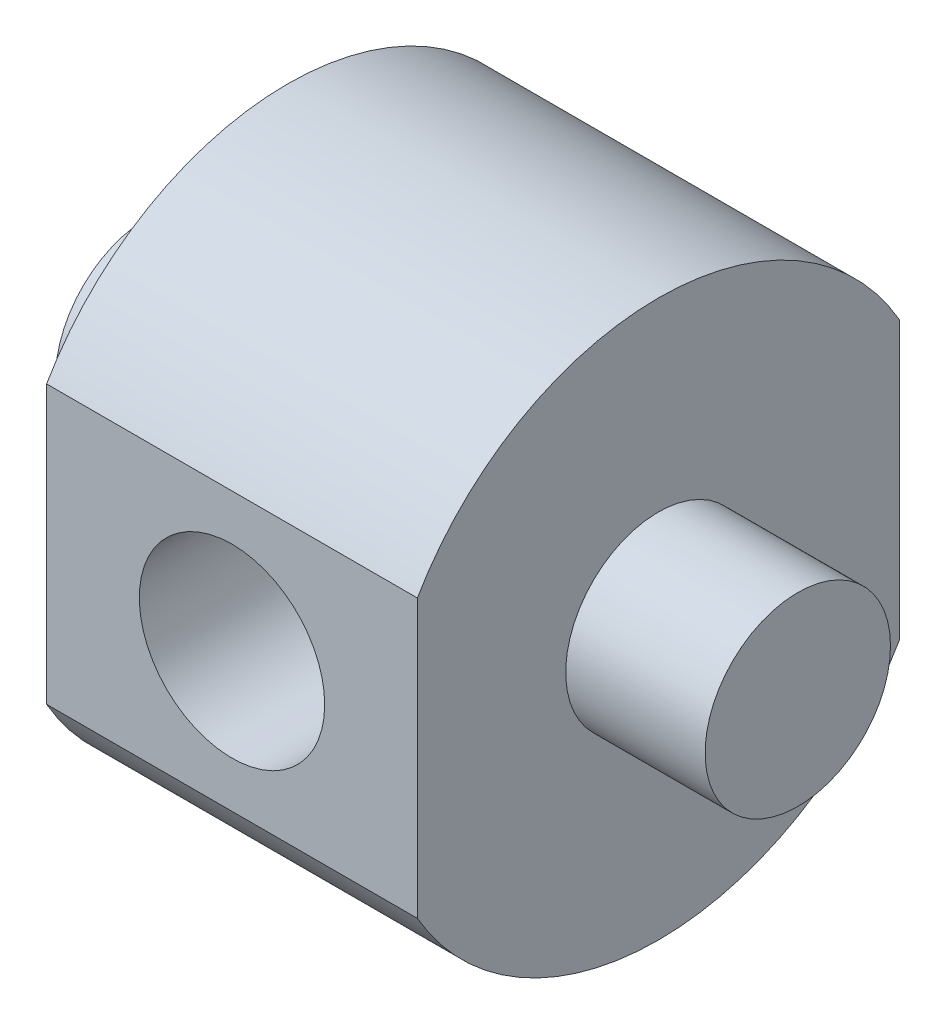
from build123d import *

# Parameters (mm, degrees)
SKETCH1_R               = 9.525
BOSS_EXTRUDE1_DEPTH     = 6.35
SKETCH2_R               = 3.175
BOSS_EXTRUDE2_DEPTH     = 4.7752
CUT_EXTRUDE1_DEPTH      = 23.064312023
CUT_EXTRUDE1_DEPTH_BACK = 23.064312023
SKETCH3_W               = 7.260653016
SKETCH3_H               = 19.707486758
SKETCH3_W_2             = 5.945134003
SKETCH3_H_2             = 19.682188315
CUT_EXTRUDE2_DEPTH      = 23.069793838
CUT_EXTRUDE2_DEPTH_BACK = 23.069793838
SKETCH4_R               = 3.175


with BuildPart() as part:
    # Sketch1 → Boss-Extrude1 (new, symmetric)
    with BuildSketch(Plane(origin=(0, 0, 0), x_dir=(0, 0, -1), z_dir=(1, 0, 0))):
        Circle(SKETCH1_R)
    extrude(amount=BOSS_EXTRUDE1_DEPTH, both=True)

    # Sketch2 → Boss-Extrude2 (add)
    with BuildSketch(Plane(origin=(6.35, 0, 0), x_dir=(0, 0, -1), z_dir=(1, 0, 0))):
        Circle(SKETCH2_R)
    boss_extrude2 = extrude(amount=BOSS_EXTRUDE2_DEPTH)

    # Mirror1: Boss-Extrude2 across plane
    add(boss_extrude2.mirror(Plane(origin=(0, 0, 0), x_dir=(0, 0, 1), z_dir=(1, 0, 0))))

    # Sketch3 → Cut-Extrude1 (cut, two sides: drawn at the far end of the back side and taken through both)
    with BuildSketch(Plane(origin=(6.35, 0, 0), x_dir=(0, 0, -1), z_dir=(1, 0, 0)).offset(-CUT_EXTRUDE1_DEPTH_BACK)):
        with Locations((-11.885326508, -0.354178196)):
            Rectangle(SKETCH3_W, SKETCH3_H)
        with Locations((11.227567002, -0.695707171)):
            Rectangle(SKETCH3_W_2, SKETCH3_H_2)
    extrude(amount=CUT_EXTRUDE1_DEPTH + CUT_EXTRUDE1_DEPTH_BACK, mode=Mode.SUBTRACT)

    # Sketch4 → Cut-Extrude2 (cut, two sides: drawn at the far end of the back side and taken through both)
    with BuildSketch(Plane.XY.offset(8.255).offset(-CUT_EXTRUDE2_DEPTH_BACK)):
        Circle(SKETCH4_R)
    extrude(amount=CUT_EXTRUDE2_DEPTH + CUT_EXTRUDE2_DEPTH_BACK, mode=Mode.SUBTRACT)


solid = part.part
